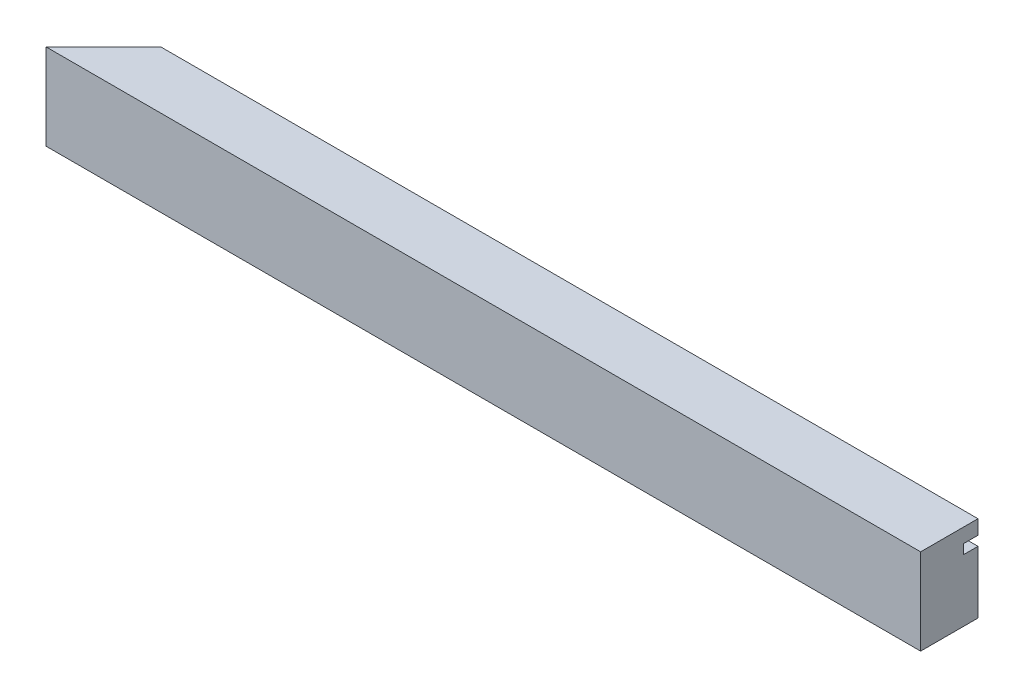
from build123d import *

# Parameters (mm, degrees)
BOSS_EXTRUDE1_DEPTH     = 18
CUT_EXTRUDE1_DEPTH      = 185.274252135
CUT_EXTRUDE1_DEPTH_BACK = 185.274252135
SKETCH2_W               = 3
SKETCH2_H               = 2


with BuildPart() as part:
    # Sketch1 → Boss-Extrude1 (new body)
    with BuildSketch(Plane(origin=(0, 0, 0), x_dir=(1, 0, 0), z_dir=(0, 1, 0))):
        Polygon((183, 0), (0, 0), (12, 12), (183, 12), align=None)
    extrude(amount=BOSS_EXTRUDE1_DEPTH)

    # Sketch2 → Cut-Extrude1 (cut, two sides: drawn at the far end of the back side and taken through both)
    with BuildSketch(Plane(origin=(183, 0, 0), x_dir=(0, 0, -1), z_dir=(1, 0, 0)).offset(-CUT_EXTRUDE1_DEPTH_BACK)):
        with Locations((10.5, 14)):
            Rectangle(SKETCH2_W, SKETCH2_H)
    extrude(amount=CUT_EXTRUDE1_DEPTH + CUT_EXTRUDE1_DEPTH_BACK, mode=Mode.SUBTRACT)


solid = part.part
